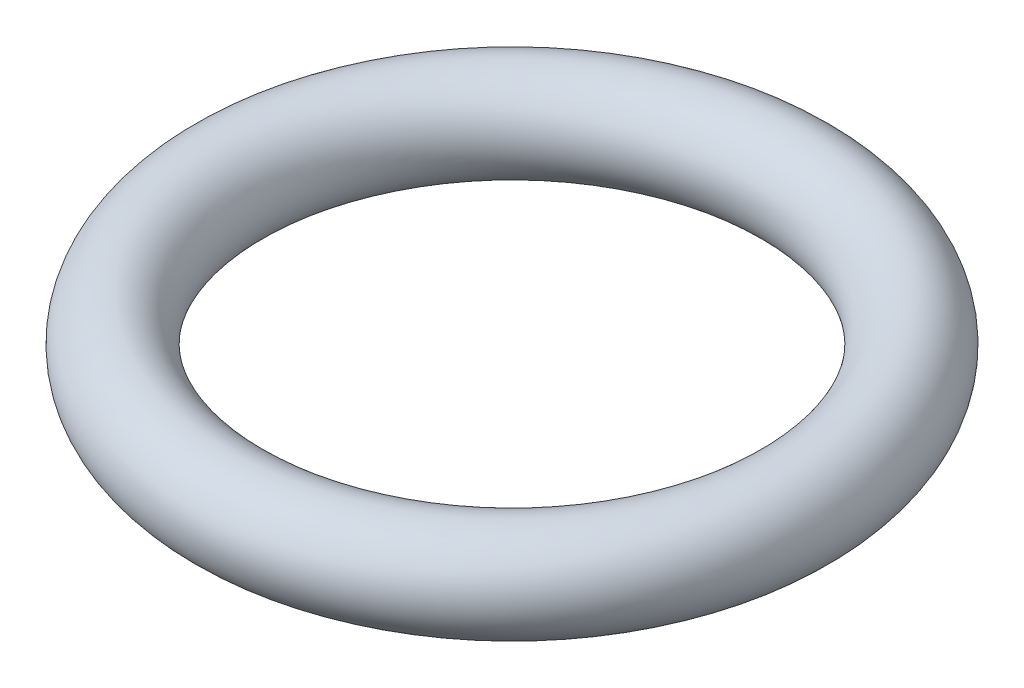
from build123d import *

# Parameters (mm, degrees)
SKETCH1_R = 25.4


with BuildPart() as part:
    # Sketch1 → Revolve1 (revolve)
    with BuildSketch(Plane.XY, mode=Mode.PRIVATE) as revolve1_sk:
        with Locations((152.4, 0)):
            Circle(SKETCH1_R)
    revolve(revolve1_sk.sketch.rotate(Axis((0, 0, 0), (0, 1, 0)), 90), axis=Axis((0, 0, 0), (0, 1, 0)))


solid = part.part
